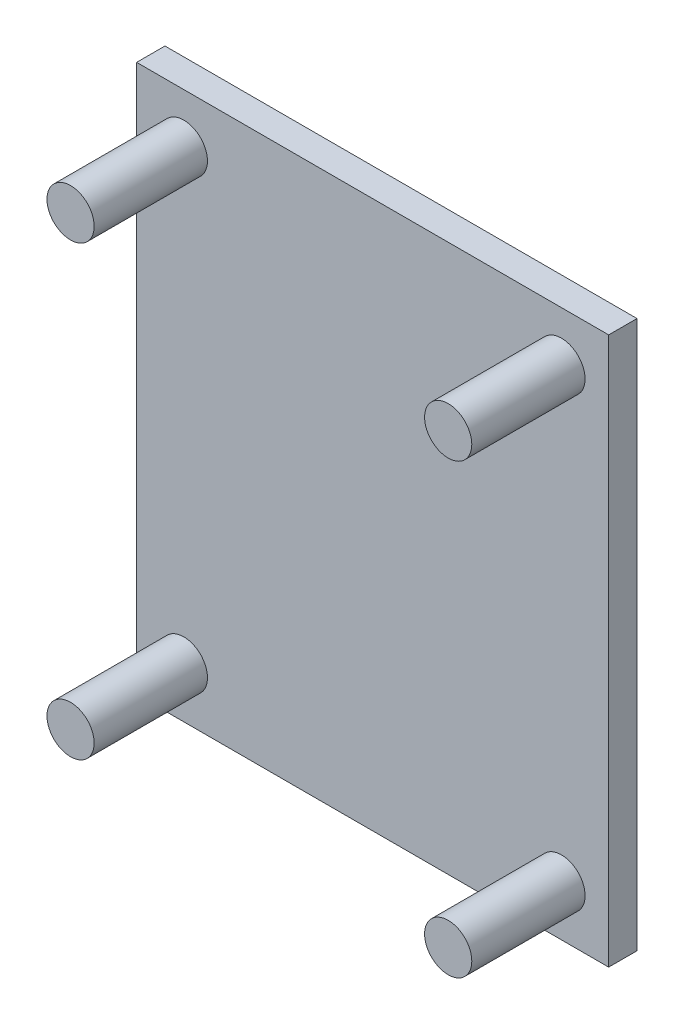
from build123d import *

# Parameters (mm, degrees)
SKETCH_1_W         = 50
SKETCH_1_H         = 58
FORMER_BASE_DEPTH  = 3
FORMER_POSTS_START = 3
SKETCH_2_R         = 2.5
FORMER_POSTS_DEPTH = 12


with BuildPart() as part:
    # Эскиз1 → Former_base (new body)
    with BuildSketch(Plane.XY):
        Rectangle(SKETCH_1_W, SKETCH_1_H)
    extrude(amount=FORMER_BASE_DEPTH)

    # Эскиз2 → Former_posts (add)
    with BuildSketch(Plane.XY.offset(FORMER_POSTS_START)):
        with Locations((-20, -23.7)):
            Circle(SKETCH_2_R)
        with Locations((-20, 23.7)):
            Circle(SKETCH_2_R)
        with Locations((20, -23.7)):
            Circle(SKETCH_2_R)
        with Locations((20, 23.7)):
            Circle(SKETCH_2_R)
    extrude(amount=FORMER_POSTS_DEPTH)


solid = part.part
